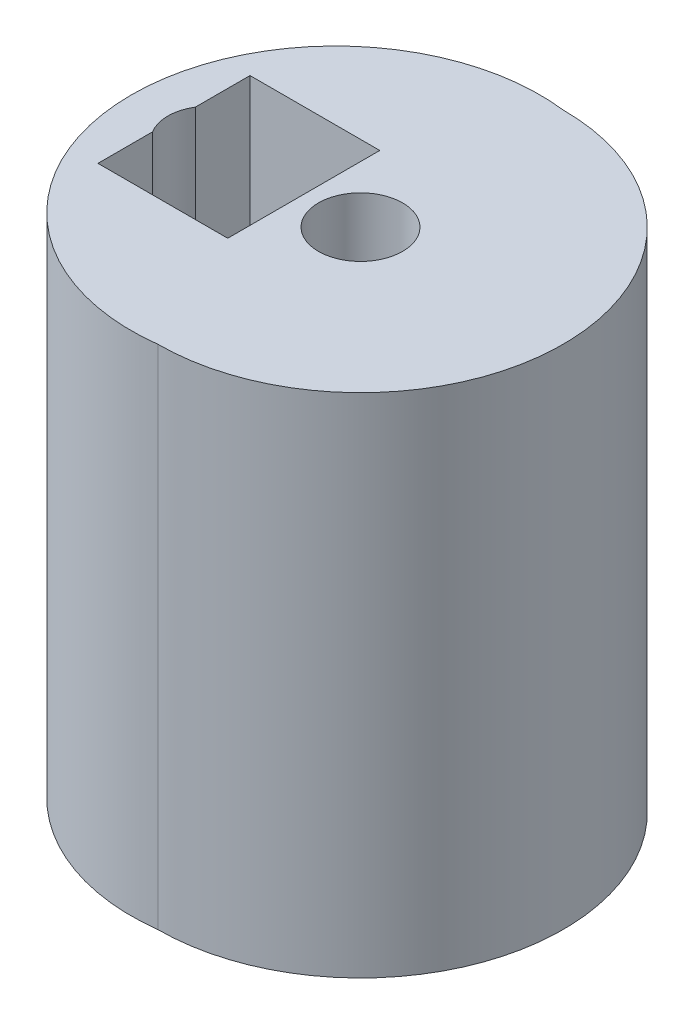
from build123d import *

# Parameters (mm, degrees)
BOSS_EXTRUDE1_DEPTH = 50
SKETCH2_R           = 13.5
CUT_EXTRUDE1_DEPTH  = 32
SKETCH3_R           = 4.15
CUT_EXTRUDE2_DEPTH  = 59.454827457
CUT_EXTRUDE3_DEPTH  = 59.454827457


with BuildPart() as part:
    # Sketch1 → Boss-Extrude1 (new body)
    with BuildSketch(Plane(origin=(0, 0, 0), x_dir=(1, 0, 0), z_dir=(0, 1, 0))):
        with BuildLine():
            ThreePointArc((0, 20), (20, 0), (0, -20))
            ThreePointArc((0, -20), (-22.604078238, 0), (0, 20))
        make_face()
    extrude(amount=BOSS_EXTRUDE1_DEPTH)

    # Sketch2 → Cut-Extrude1 (cut)
    with BuildSketch(Plane.XZ):
        with Locations(Location((0, 0, 0), (0, 0, 270))):
            Circle(SKETCH2_R)
    extrude(amount=-CUT_EXTRUDE1_DEPTH, mode=Mode.SUBTRACT)

    # Sketch3 → Cut-Extrude2 (cut, through all)
    with BuildSketch(Plane(origin=(0, 50, 0), x_dir=(1, 0, 0), z_dir=(0, 1, 0))):
        with Locations(Location((0, 0, 0), (0, 0, 270))):
            Circle(SKETCH3_R)
    extrude(amount=-CUT_EXTRUDE2_DEPTH, mode=Mode.SUBTRACT)

    # Sketch4 → Cut-Extrude3 (cut, through all)
    with BuildSketch(Plane(origin=(0, 50, 0), x_dir=(1, 0, 0), z_dir=(0, 1, 0))):
        with BuildLine():
            Line((-18.4, 7.5), (-18.4, 2.107130751))
            ThreePointArc((-18.4, 2.107130751), (-19, 0), (-18.4, -2.107130751))
            Line((-18.4, -2.107130751), (-18.4, -7.5))
            Line((-18.4, -7.5), (-5.6, -7.5))
            Line((-5.6, -7.5), (-5.6, 7.5))
            Line((-5.6, 7.5), (-18.4, 7.5))
        make_face()
    extrude(amount=-CUT_EXTRUDE3_DEPTH, mode=Mode.SUBTRACT)


solid = part.part
